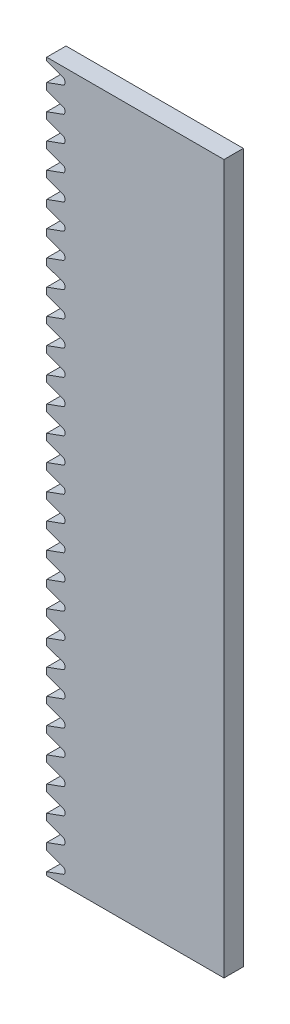
from build123d import *

# Parameters (mm, degrees)
EXTRUDECI_DEPTH                = 2
EXTRUDECI_DEPTH_BACK           = 2
SKETCHCI_M_STRSKETCHNAME_W     = 36.666666667
SKETCHCI_M_STRSKETCHNAME_H     = 146.607657168
TOOTHEXTRUDECUTSPURGEAR2_DEPTH = 9.525
PATTERNSPURGEAR2_COUNT         = 28
PATTERNSPURGEAR2_PITCH         = 5.235987835


with BuildPart() as part:
    # SketchCI.m_strSketchName → ExtrudeCI (new, two sides: drawn at the far end of the back side and taken through both)
    with BuildSketch(Plane.XY.offset(-EXTRUDECI_DEPTH_BACK)):
        with Locations((16.666666666, -70.685834706)):
            Rectangle(SKETCHCI_M_STRSKETCHNAME_W, SKETCHCI_M_STRSKETCHNAME_H)
    extrude(amount=EXTRUDECI_DEPTH + EXTRUDECI_DEPTH_BACK)

    # SketchToothSpurGear2 → ToothExtrudeCutSpurGear2 (cut, symmetric)
    with BuildSketch(Plane.XY):
        with BuildLine():
            Line((-1.666666667, 1.915613996), (-1.666666667, -1.915613996))
            Line((-1.666666667, -1.915613996), (1.754343405, -0.670468159))
            ThreePointArc((1.754343405, -0.670468159), (1.992909355, -0.487410067), (2.083333333, -0.200621849))
            Line((2.083333333, -0.200621849), (2.083333333, 0.200621849))
            ThreePointArc((2.083333333, 0.200621849), (1.992909355, 0.487410067), (1.754343405, 0.670468159))
            Line((1.754343405, 0.670468159), (-1.666666667, 1.915613996))
        make_face()
    toothextrudecutspurgear2 = extrude(amount=TOOTHEXTRUDECUTSPURGEAR2_DEPTH, both=True, mode=Mode.SUBTRACT)

    # PatternSpurGear2: ToothExtrudeCutSpurGear2 ×28
    with Locations(*[(0, -i * PATTERNSPURGEAR2_PITCH, 0) for i in range(1, PATTERNSPURGEAR2_COUNT)]):
        add(toothextrudecutspurgear2, mode=Mode.SUBTRACT)


solid = part.part
